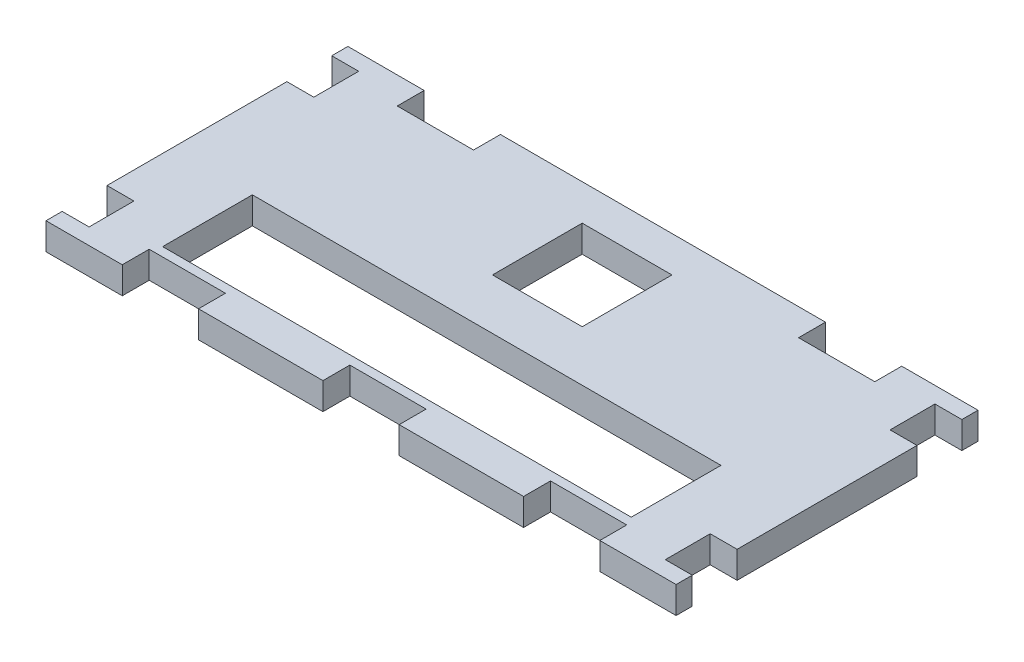
from build123d import *

# Parameters (mm, degrees)
CROQUIS1_W              = 52.23
CROQUIS1_H              = 10
CROQUIS1_W_2            = 10
SALIENTE_EXTRUIR1_DEPTH = 3


with BuildPart() as part:
    # Croquis1 → Saliente-Extruir1 (new body)
    with BuildSketch(Plane(origin=(0, 0, 0), x_dir=(1, 0, 0), z_dir=(0, 1, 0))):
        Polygon((17, 33.65), (17, 30.65), (8.5, 30.65), (8.5, 33.65), (0, 33.65), (0, 31.85), (3, 31.85), (3, 26.85), (0, 26.85), (0, 6.8), (3, 6.8), (3, 1.8), (0, 1.8), (0, 0), (8.5, 0), (8.5, 3), (17, 3), (17, 0), (30.865, 0), (30.865, 3), (39.365, 3), (39.365, 0), (53.23, 0), (53.23, 3), (61.73, 3), (61.73, 0), (70.23, 0), (70.23, 1.8), (67.23, 1.8), (67.23, 6.8), (70.23, 6.8), (70.23, 26.85), (67.23, 26.85), (67.23, 31.85), (70.23, 31.85), (70.23, 33.65), (61.73, 33.65), (61.73, 30.65), (53.23, 30.65), (53.23, 33.65), align=None)
        with Locations((35.115, 9)):
            Rectangle(CROQUIS1_W, CROQUIS1_H, mode=Mode.SUBTRACT)
        with Locations((35.115, 24.65)):
            Rectangle(CROQUIS1_W_2, CROQUIS1_H, mode=Mode.SUBTRACT)
    extrude(amount=SALIENTE_EXTRUIR1_DEPTH)


solid = part.part
